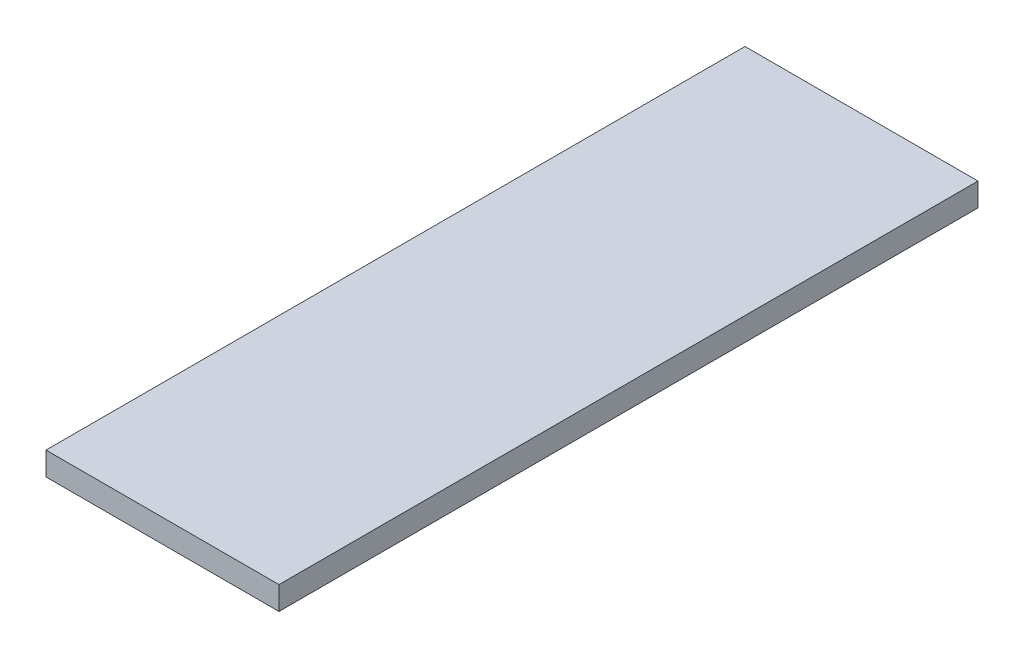
from build123d import *

# Parameters (mm, degrees)
SKETCH_1_W        = 100
SKETCH_1_H        = 300
EXTRUDE_320_DEPTH = 10


with BuildPart() as part:
    # Эскиз1 → Extrude 320 (new body)
    with BuildSketch(Plane(origin=(0, 0, 0), x_dir=(1, 0, 0), z_dir=(0, 1, 0))):
        with Locations((50, 150)):
            Rectangle(SKETCH_1_W, SKETCH_1_H)
    extrude(amount=EXTRUDE_320_DEPTH)


solid = part.part
